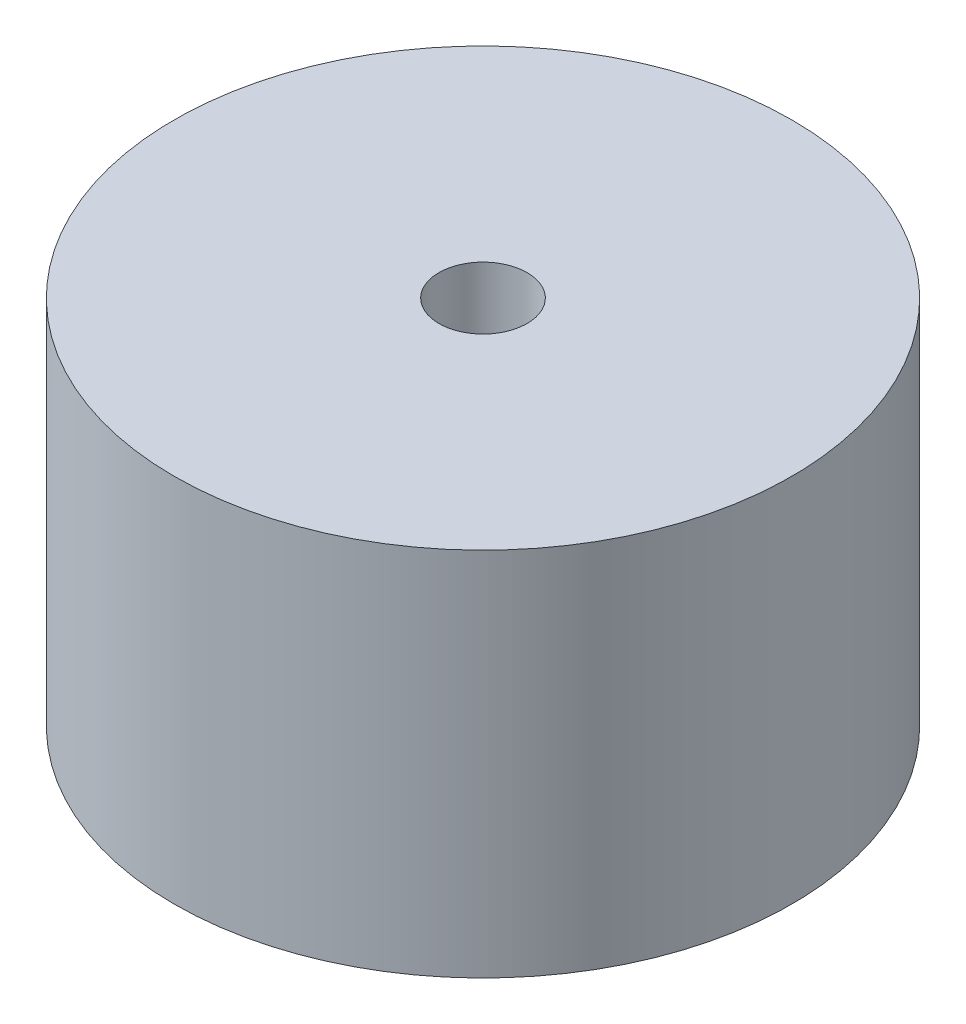
from build123d import *

# Parameters (mm, degrees)
ESBO_O1_R                = 17.5
ESBO_O1_R_2              = 2.5
RESSALTO_EXTRUS_O1_DEPTH = 21


with BuildPart() as part:
    # Esboço1 → Ressalto-extrusão1 (new body)
    with BuildSketch(Plane(origin=(0, 0, 0), x_dir=(1, 0, 0), z_dir=(0, 1, 0))):
        with Locations(Location((0.489666327, 0, 0), (0, 0, 90))):
            Circle(ESBO_O1_R)
        with Locations(Location((0.489666327, 0, 0), (0, 0, 90))):
            Circle(ESBO_O1_R_2, mode=Mode.SUBTRACT)
    extrude(amount=RESSALTO_EXTRUS_O1_DEPTH)


solid = part.part
